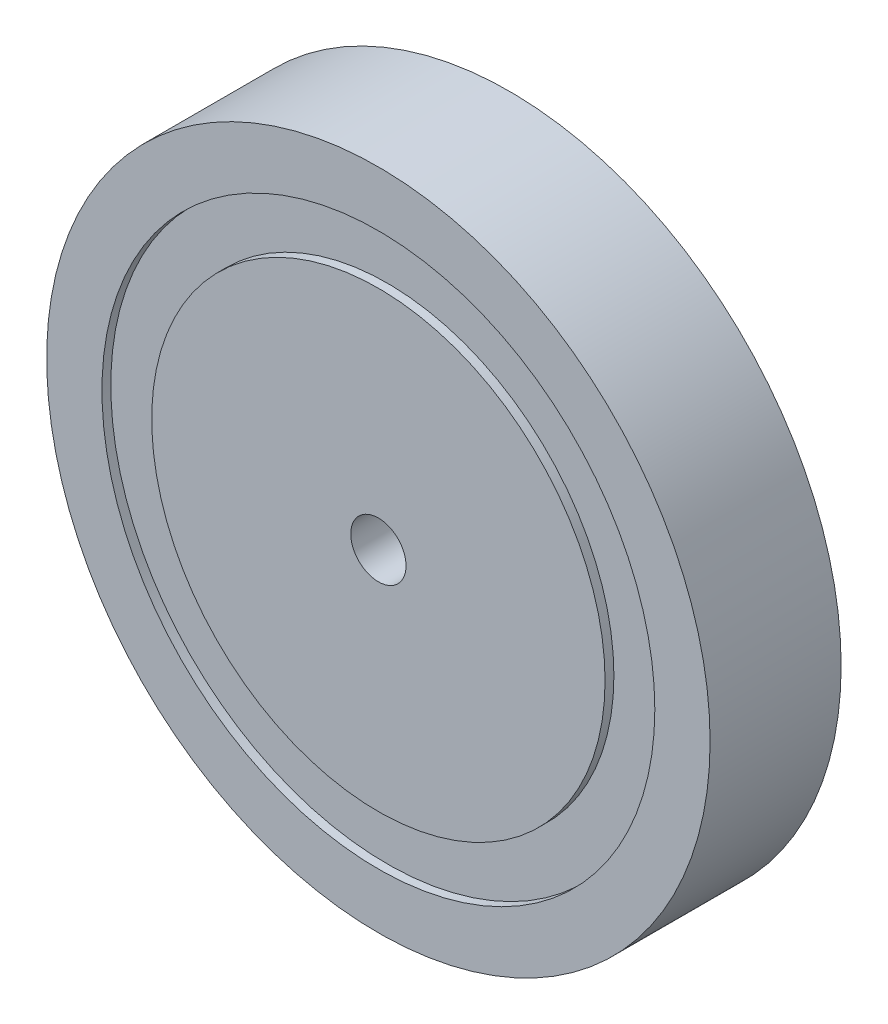
from build123d import *

# Parameters (mm, degrees)
SKETCH1_R           = 60
SKETCH1_R_2         = 50
SKETCH1_R_3         = 41
SKETCH1_R_4         = 5
BOSS_EXTRUDE1_DEPTH = 11.85
SKETCH2_R           = 50
SKETCH2_R_2         = 41
CUT_EXTRUDE1_DEPTH  = 1.6
SKETCH3_R           = 24.75
CUT_EXTRUDE2_DEPTH  = 3


with BuildPart() as part:
    # Sketch1 → Boss-Extrude1 (new, symmetric)
    # profile 1 of 3: a face of its own
    with BuildSketch(Plane.XY):
        Circle(SKETCH1_R)
        Circle(SKETCH1_R_2, mode=Mode.SUBTRACT)
    # profile 2 of 3: a face of its own
    with BuildSketch(Plane.XY):
        Circle(SKETCH1_R_2)
        Circle(SKETCH1_R_3, mode=Mode.SUBTRACT)
    # profile 3 of 3: a face of its own
    with BuildSketch(Plane.XY):
        Circle(SKETCH1_R_3)
        Circle(SKETCH1_R_4, mode=Mode.SUBTRACT)
    extrude(amount=BOSS_EXTRUDE1_DEPTH, both=True)

    # Sketch2 → Cut-Extrude1 (cut)
    with BuildSketch(Plane.XY.offset(11.85)):
        Circle(SKETCH2_R)
        Circle(SKETCH2_R_2, mode=Mode.SUBTRACT)
    extrude(amount=-CUT_EXTRUDE1_DEPTH, mode=Mode.SUBTRACT)

    # Sketch3 → Cut-Extrude2 (cut)
    with BuildSketch(Plane(origin=(0, 0, -11.85), x_dir=(-1, 0, 0), z_dir=(0, 0, -1))):
        Circle(SKETCH3_R)
    extrude(amount=-CUT_EXTRUDE2_DEPTH, mode=Mode.SUBTRACT)


solid = part.part
